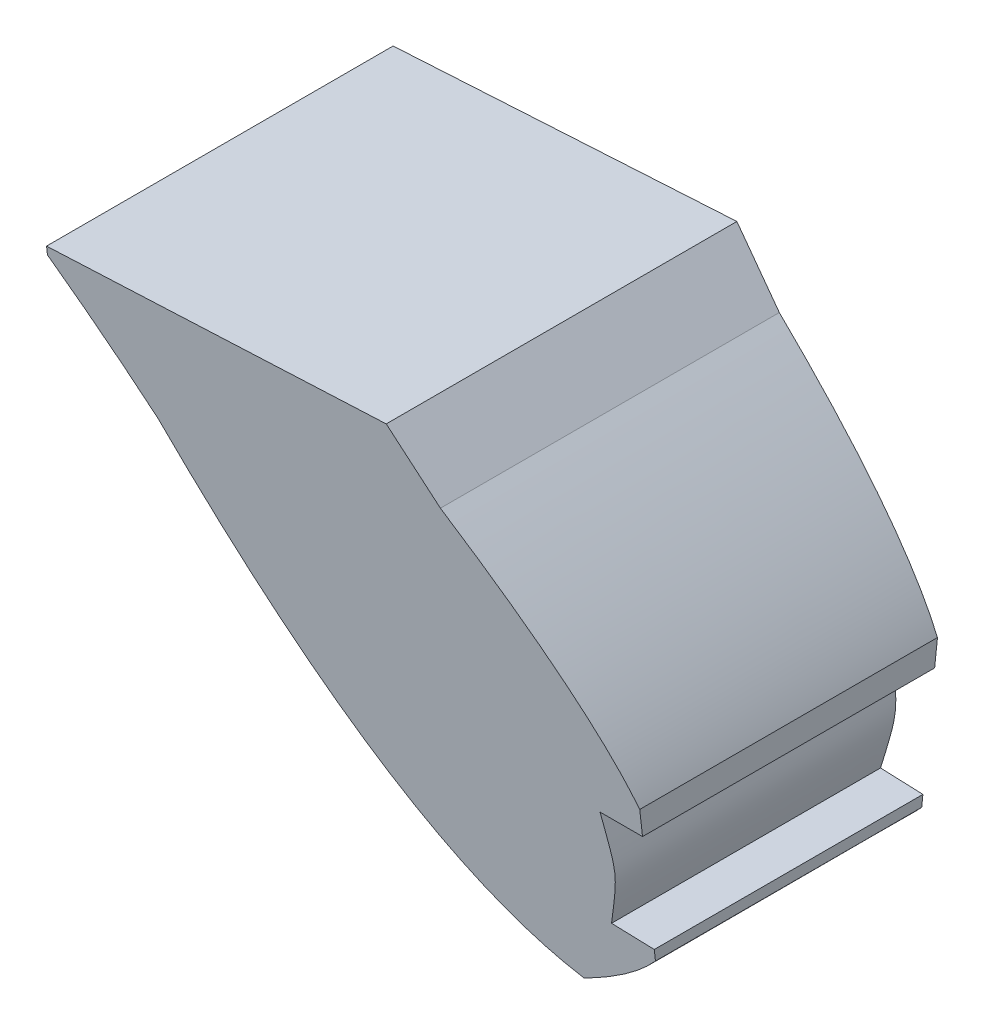
from build123d import *

# Parameters (mm, degrees)
SALIENTE_EXTRUIR1_DEPTH      = 7.21
SALIENTE_EXTRUIR2_DEPTH      = 7.21
SALIENTE_EXTRUIR2_DEPTH_BACK = 7.21
CORTAR_EXTRUIR2_DEPTH        = 28.232395202
CORTAR_EXTRUIR2_DEPTH_BACK   = 28.232395202


with BuildPart() as part:
    # Croquis1 → Saliente-Extruir1 (new, symmetric)
    with BuildSketch(Plane.XY):
        with BuildLine():
            add(Edge.make_bspline(
                [(-18.945192114, 7.540918896), (-10.215008384, -3.697644103), (-2.846604825, -5.059081104)],
                knots=[0.497667241, 0.497667241, 0.497667241, 0.49955428, 0.49955428, 0.49955428], degree=2, weights=[1, 1, 1]))
            add(Edge.make_bspline(
                [(-2.846604825, -5.059081104), (-0.742366882, -3.9352066), (0.355125, -2.723253227)],
                knots=[0.498812075, 0.498812075, 0.498812075, 0.499412845, 0.499412845, 0.499412845], degree=2, weights=[1, 1, 1]))
            Line((0.355125, -2.723253227), (0.355125, -2.284841781))
            Line((0.355125, -2.284841781), (-1.394875, -2.223730435))
            add(Edge.make_bspline(
                [(-1.394875, -2.223730435), (-0.90753067, -0.123730435), (-1.394875, 1.976269565)],
                knots=[0, 0, 0, 1, 1, 1], degree=2, weights=[1, 3.231801219, 1]))
            Line((-1.394875, 1.976269565), (0.355125, 2.284841781))
            Line((0.355125, 2.284841781), (0.355125, 3.001549529))
            add(Edge.make_bspline(
                [(0.355125, 3.001549529), (-1.44872627, 6.058427314), (-6.994875026, 10.477389992)],
                knots=[0.500820705, 0.500820705, 0.500820705, 0.502013312, 0.502013312, 0.502013312], degree=2, weights=[1, 1, 1]))
            Line((-6.994875026, 10.477389992), (-8.981845695, 12.608155172))
            Line((-8.981845695, 12.608155172), (-23.035921146, 11.871612288))
            Line((-23.035921146, 11.871612288), (-23.035921146, 11.54013782))
            ThreePointArc((-23.035921146, 11.54013782), (-20.949684518, 9.582335705), (-18.945192114, 7.540918896))
        make_face()
    extrude(amount=SALIENTE_EXTRUIR1_DEPTH, both=True)

    # Croquis4 → Saliente-Extruir2 (add, two sides: drawn at the far end of the back side and taken through both)
    with BuildSketch(Plane.XY.offset(-SALIENTE_EXTRUIR2_DEPTH_BACK)):
        Polygon((-1.394875, 1.976269565), (0.355125, 2.284841781), (0.355125, 1.976269565), align=None)
    extrude(amount=SALIENTE_EXTRUIR2_DEPTH + SALIENTE_EXTRUIR2_DEPTH_BACK)

    # Croquis6 → Cortar-Extruir2 (cut, two sides: drawn at the far end of the back side and taken through both)
    with BuildSketch(Plane(origin=(0, 0, 0), x_dir=(0, 0, -1), z_dir=(1, 0, 0)).offset(-CORTAR_EXTRUIR2_DEPTH_BACK)):
        Polygon((7.21, 12.608155172), (7.21, -5.059081104), (5.21, -5.059081104), align=None)
        Polygon((-7.21, 12.608155172), (-7.21, -5.059081104), (-5.21, -5.059081104), align=None)
    extrude(amount=CORTAR_EXTRUIR2_DEPTH + CORTAR_EXTRUIR2_DEPTH_BACK, mode=Mode.SUBTRACT)


solid = part.part
